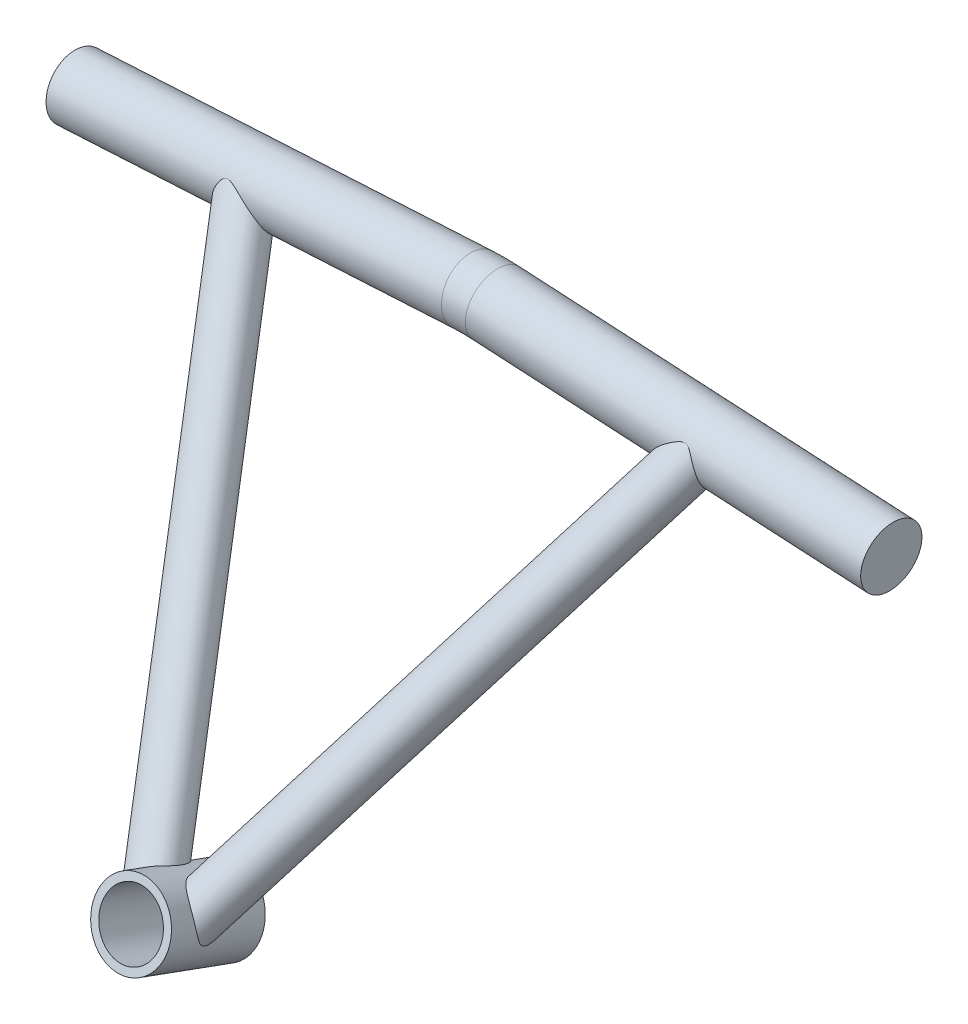
from build123d import *

# Parameters (mm, degrees)
SKETCH1_R           = 15.875
BOSS_EXTRUDE1_DEPTH = 20.701
SWEEP1_PROFILE_R    = 9.525
SWEEP2_PROFILE_R    = 9.525
CUT_EXTRUDE1_REACH  = 233.612
SKETCH2_R           = 12.7
SKETCH36_R          = 7.9375
CUT_EXTRUDE2_DEPTH  = 127
SKETCH37_R          = 7.9375
CUT_EXTRUDE3_DEPTH  = 127
SWEEP3_PROFILE_R    = 12.7


with BuildPart() as part:
    # Sketch1 → Boss-Extrude1 (new, symmetric)
    with BuildSketch(Plane(origin=(0, 0, 0), x_dir=(1, 0, 0), z_dir=(0, 0.34202014332566943, 0.9396926207859081))):
        with Locations(Location((0, 0, 0), (0, 0, 270))):
            Circle(SKETCH1_R)
    extrude(amount=BOSS_EXTRUDE1_DEPTH, both=True)

    # Sweep1: sweep along a path in Sketch4
    with BuildLine(Plane(origin=(0, 3.126764616, 3.726332964), x_dir=(1, 0, 0), z_dir=(0, 0.6427876096865406, 0.7660444431189771))) as sweep1_path:
        Line((-5.08, -4.081701322), (-96.768607765, 201.854283468))
    # Sweep1 profile (on start of the path) → Sweep1 (sweep)
    with BuildSketch(Plane(origin=(-5.08, 0, 6.35), x_dir=(0, 0.6427876096865406, 0.7660444431189771), z_dir=(-0.4067366430758009, 0.6998164213636971, -0.5872157010580841))):
        Circle(SWEEP1_PROFILE_R)
    sweep(path=sweep1_path.line)

    # Sweep2: sweep along a path in Sketch15
    with BuildLine(Plane(origin=(0, 3.126764616, 3.726332964), x_dir=(1, 0, 0), z_dir=(0, 0.6427876096865406, 0.7660444431189771))) as sweep2_path:
        Line((5.08, -4.081701322), (96.768607765, 201.854283468))
    # Sweep2 profile (on start of the path) → Sweep2 (sweep)
    with BuildSketch(Plane(origin=(5.08, 0, 6.35), x_dir=(0, 0.6427876096865406, 0.766044443118977), z_dir=(0.40673664307580104, 0.6998164213636969, -0.587215701058084))):
        Circle(SWEEP2_PROFILE_R)
    sweep(path=sweep2_path.line)

    # Sketch2 → Cut-Extrude1 (cut, up to next)
    with BuildSketch(Plane(origin=(0, -7.080158987, -19.452576943), x_dir=(-1, 0, 0), z_dir=(0, -0.34202014332566943, -0.9396926207859081)), mode=Mode.PRIVATE) as cut_extrude1_sk1:
        with Locations(Location((0, 0, 0), (0, 0, 90))):
            Circle(SKETCH2_R)
    cut_extrude1_tool1 = extrude(cut_extrude1_sk1.sketch, amount=-CUT_EXTRUDE1_REACH, mode=Mode.PRIVATE) & part.part
    add(cut_extrude1_tool1.solids().sort_by_distance((0, -7.080159, -19.452577))[0], mode=Mode.SUBTRACT)

    # Sketch36 → Cut-Extrude2 (cut)
    with BuildSketch(Plane(origin=(-91.012368417, 156.592603715, -131.396796022), x_dir=(0.9135454575587967, 0.3115870518309583, -0.26143489840681283), z_dir=(-0.40673664307580104, 0.6998164213636969, -0.5872157010580842))):
        with Locations(Location((-6.300922529, -4.864467561, 0), (0, 0, 270.000776077))):
            Circle(SKETCH36_R)
    extrude(amount=-CUT_EXTRUDE2_DEPTH, mode=Mode.SUBTRACT)

    # Sketch37 → Cut-Extrude3 (cut)
    with BuildSketch(Plane(origin=(91.012368417, 156.592603715, -131.396796022), x_dir=(0.9135454575587966, -0.3115870518309586, 0.261434898406813), z_dir=(0.4067366430758013, 0.699816421363697, -0.5872157010580837))):
        with Locations(Location((6.300922529, -4.864467561, 0), (0, 0, 269.999223923))):
            Circle(SKETCH37_R)
    extrude(amount=-CUT_EXTRUDE3_DEPTH, mode=Mode.SUBTRACT)

    # Sweep3: sweep along a path in Sketch40
    with BuildLine(Plane(origin=(-106.934, 0, -127), x_dir=(1, 0, 0), z_dir=(0, 0, 1))) as sweep3_path:
        Line((-62.089448271, 150.498042412), (101.994706052, 159.628680082))
        ThreePointArc((101.994706052, 159.628680082), (106.934, 159.766), (111.873293948, 159.628680082))
        Line((111.873293948, 159.628680082), (275.957448271, 150.498042412))
    # Sweep3 profile (on start of the path) → Sweep3 (sweep)
    with BuildSketch(Plane(origin=(-169.023448271, 150.498042412, -127), x_dir=(-0.0555601119023539, 0.9984553440016224, 0), z_dir=(0.9984553440016224, 0.0555601119023539, 0))):
        Circle(SWEEP3_PROFILE_R)
    sweep(path=sweep3_path.line)


solid = part.part
